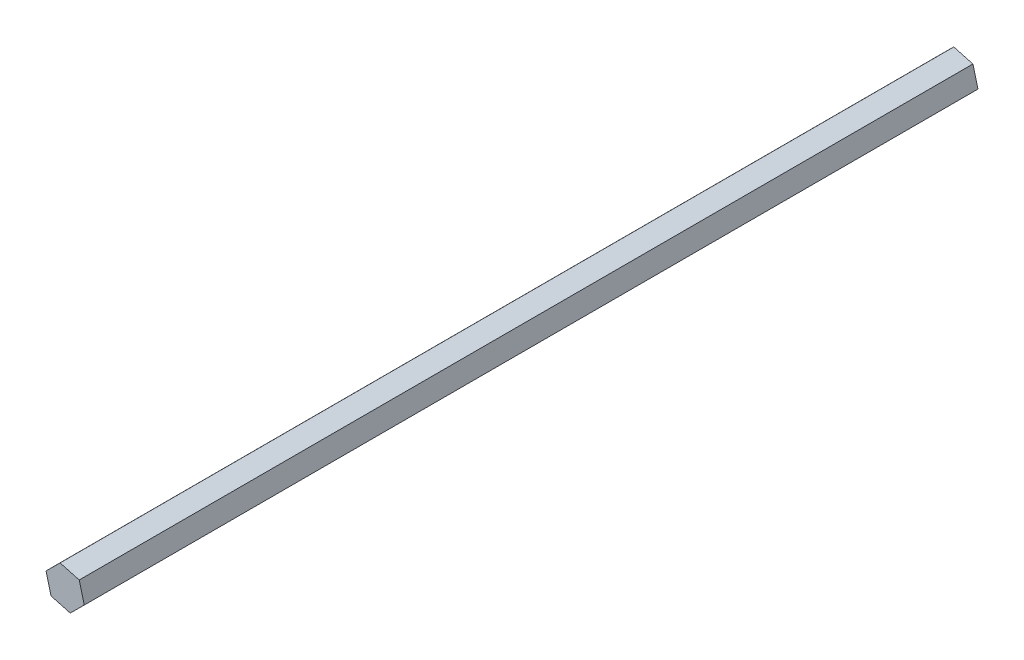
from build123d import *

# Parameters (mm, degrees)
BOSS_EXTRUDE1_DEPTH = 330.2


with BuildPart() as part:
    # Sketch1 → Boss-Extrude1 (new body)
    with BuildSketch(Plane.XY):
        Polygon((2.77034033, -2.933301526), (7.972404746, 2.234082642), (6.098350994, 9.322894663), (-0.977767175, 11.244322516), (-6.179831592, 6.076938347), (-4.305777839, -1.011873673), align=None)
    extrude(amount=BOSS_EXTRUDE1_DEPTH)


solid = part.part
